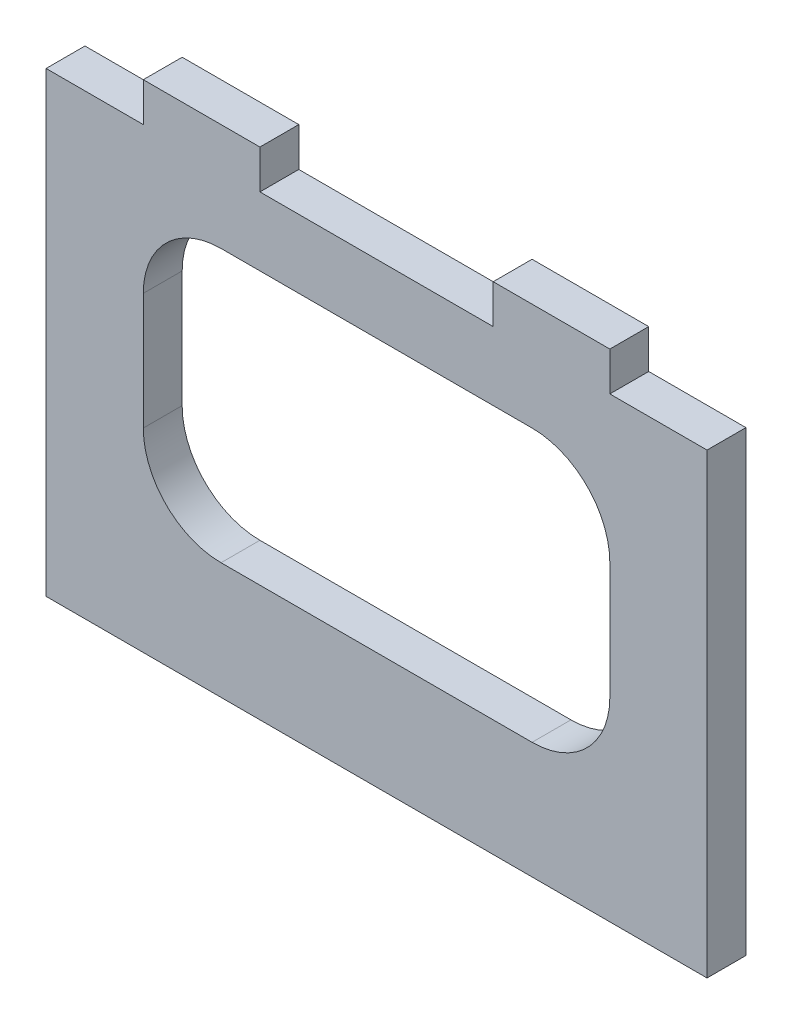
from build123d import *

# Parameters (mm, degrees)
SKIZZE1_W                       = 85
SKIZZE1_H                       = 58.8
AUFSATZ_LINEAR_AUSTRAGEN1_DEPTH = 5
SKIZZE2_W                       = 60
SKIZZE2_H                       = 35
SCHNITT_LINEAR_AUSTRAGEN1_DEPTH = 104.476760676
VERRUNDUNG1_R                   = 10
SKIZZE3_W                       = 15
SKIZZE3_H                       = 5
AUFSATZ_LINEAR_AUSTRAGEN2_DEPTH = 5


with BuildPart() as part:
    # Skizze1 → Aufsatz-Linear austragen1 (new body)
    with BuildSketch(Plane.XY):
        with Locations((42.5, 29.4)):
            Rectangle(SKIZZE1_W, SKIZZE1_H)
    extrude(amount=AUFSATZ_LINEAR_AUSTRAGEN1_DEPTH)

    # Skizze2 → Schnitt-Linear austragen1 (cut, through all)
    with BuildSketch(Plane.XY.offset(5)):
        with Locations((42.5, 32.5)):
            Rectangle(SKIZZE2_W, SKIZZE2_H)
    extrude(amount=-SCHNITT_LINEAR_AUSTRAGEN1_DEPTH, mode=Mode.SUBTRACT)

    # Verrundung1
    verrundung1_edges = [part.edges().sort_by_distance(p)[0] for p in [
        (12.5, 15, 2.5),
        (12.5, 50, 2.5),
        (72.5, 50, 2.5),
        (72.5, 15, 2.5),
    ]]
    fillet(verrundung1_edges, radius=VERRUNDUNG1_R)

    # Skizze3 → Aufsatz-Linear austragen2 (add)
    with BuildSketch(Plane(origin=(0, 58.8, 0), x_dir=(1, 0, 0), z_dir=(0, 1, 0))):
        with Locations((65, -2.5)):
            Rectangle(SKIZZE3_W, SKIZZE3_H)
        with Locations((20, -2.5)):
            Rectangle(SKIZZE3_W, SKIZZE3_H)
    extrude(amount=AUFSATZ_LINEAR_AUSTRAGEN2_DEPTH)


solid = part.part
